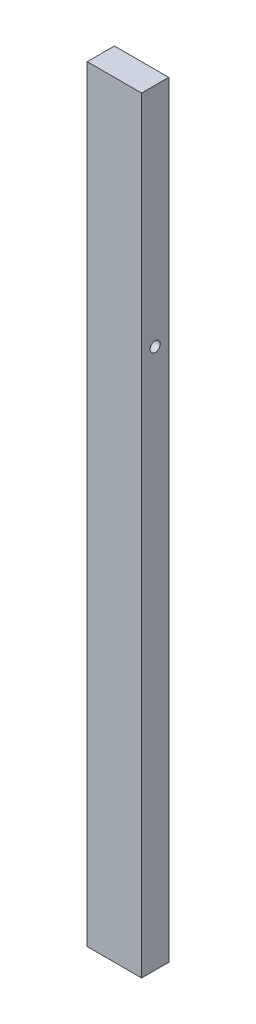
from build123d import *

# Parameters (mm, degrees)
ESQUISSE1_W             = 48
ESQUISSE1_H             = 677
BOSS_EXTRU_1_DEPTH      = 12
ESQUISSE3_R             = 4.5
ENL_V_MAT_EXTRU_2_DEPTH = 343.096843014
ESQUISSE5_R             = 6.75
ENL_V_MAT_EXTRU_4_DEPTH = 10


with BuildPart() as part:
    # Esquisse1 → Boss.-Extru.1 (new, symmetric)
    with BuildSketch(Plane.XY):
        Rectangle(ESQUISSE1_W, ESQUISSE1_H)
    extrude(amount=BOSS_EXTRU_1_DEPTH, both=True)

    # Esquisse3 → Enlèv. mat.-Extru.2 (cut, through all)
    with BuildSketch(Plane.ZY.offset(24)):
        with Locations((0, 138.5)):
            Circle(ESQUISSE3_R)
    extrude(amount=-ENL_V_MAT_EXTRU_2_DEPTH, mode=Mode.SUBTRACT)

    # Esquisse5 → Enlèv. mat.-Extru.4 (cut)
    with BuildSketch(Plane.ZY.offset(24)):
        with Locations((0, 138.5)):
            Circle(ESQUISSE5_R)
    extrude(amount=-ENL_V_MAT_EXTRU_4_DEPTH, mode=Mode.SUBTRACT)


solid = part.part
